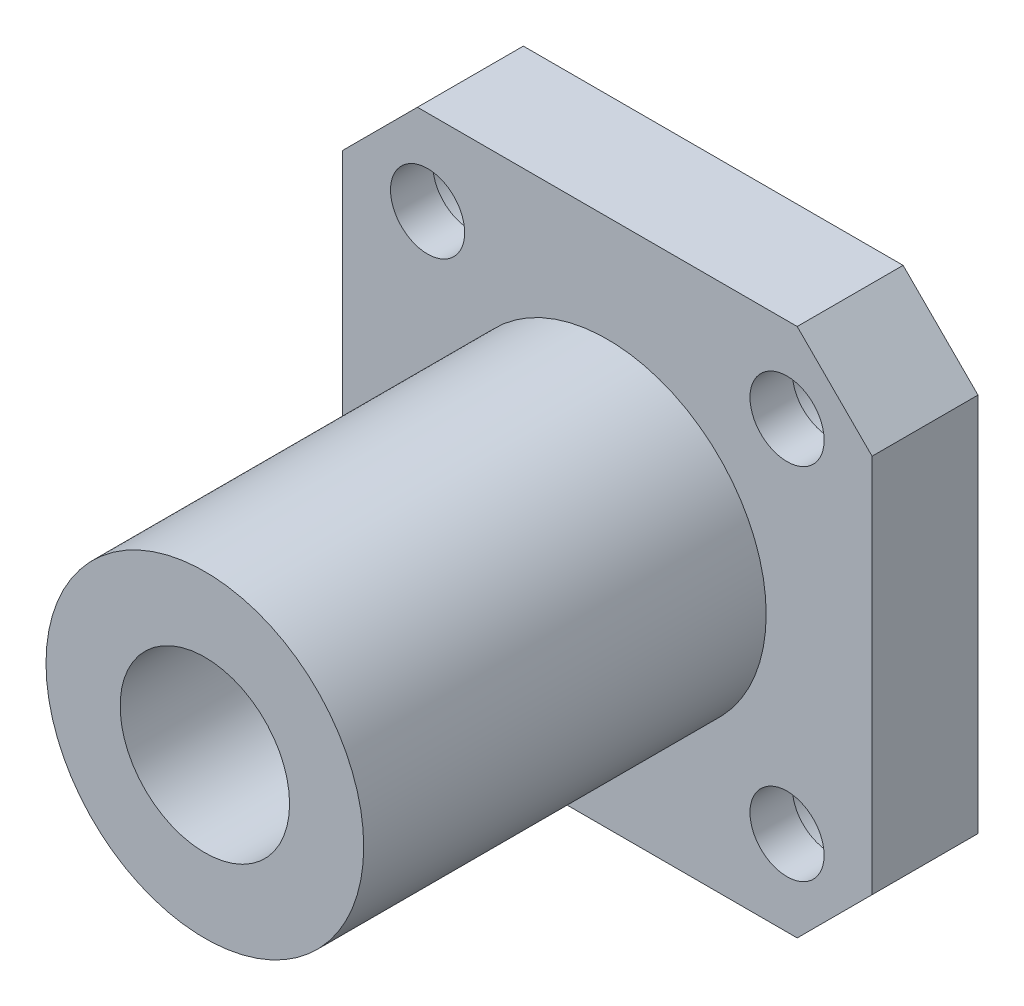
from build123d import *

# Parameters (mm, degrees)
SKETCH2_R           = 1.75
SKETCH2_R_2         = 4
BOSS_EXTRUDE1_DEPTH = 5
SKETCH3_R           = 7.5
SKETCH3_R_2         = 4
BOSS_EXTRUDE2_DEPTH = 19
SKETCH4_R           = 2.8
CUT_EXTRUDE1_DEPTH  = 3


with BuildPart() as part:
    # Sketch2 → Boss-Extrude1 (new body)
    with BuildSketch(Plane.XY):
        Polygon((-8.964466094, 12.5), (8.964466094, 12.5), (12.5, 8.964466094), (12.5, -8.964466094), (8.964466094, -12.5), (-8.964466094, -12.5), (-12.5, -8.964466094), (-12.5, 8.964466094), align=None)
        with Locations((-8.485281374, 8.485281374)):
            Circle(SKETCH2_R, mode=Mode.SUBTRACT)
        with Locations((8.485281374, -8.485281374)):
            Circle(SKETCH2_R, mode=Mode.SUBTRACT)
        with Locations((8.485281374, 8.485281374)):
            Circle(SKETCH2_R, mode=Mode.SUBTRACT)
        with Locations((-8.485281374, -8.485281374)):
            Circle(SKETCH2_R, mode=Mode.SUBTRACT)
        Circle(SKETCH2_R_2, mode=Mode.SUBTRACT)
    extrude(amount=BOSS_EXTRUDE1_DEPTH)

    # Sketch3 → Boss-Extrude2 (add)
    with BuildSketch(Plane.XY.offset(5)):
        Circle(SKETCH3_R)
        Circle(SKETCH3_R_2, mode=Mode.SUBTRACT)
    extrude(amount=BOSS_EXTRUDE2_DEPTH)

    # Sketch4 → Cut-Extrude1 (cut)
    with BuildSketch(Plane(origin=(0, 0, 0), x_dir=(-1, 0, 0), z_dir=(0, 0, -1))):
        with Locations((-8.485281374, 8.485281374)):
            Circle(SKETCH4_R)
        with Locations((8.485281374, 8.485281374)):
            Circle(SKETCH4_R)
        with Locations((8.485281374, -8.485281374)):
            Circle(SKETCH4_R)
        with Locations((-8.485281374, -8.485281374)):
            Circle(SKETCH4_R)
    extrude(amount=-CUT_EXTRUDE1_DEPTH, mode=Mode.SUBTRACT)


solid = part.part
